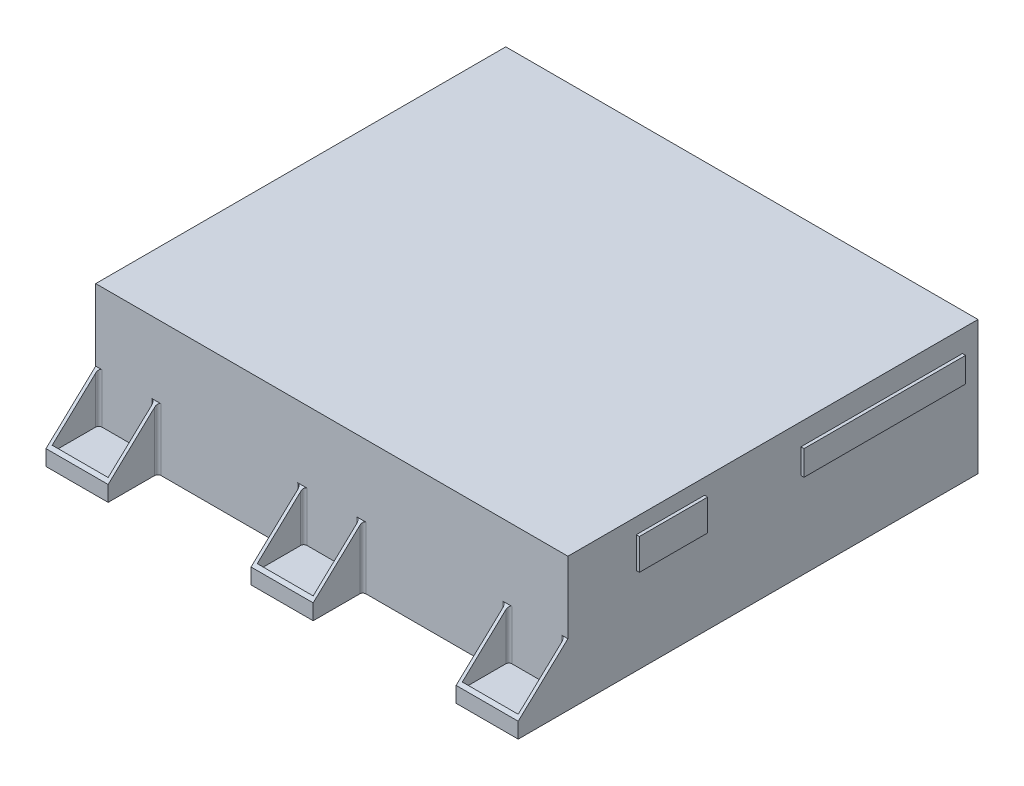
from build123d import *

# Parameters (mm, degrees)
SKETCH1_W           = 152
SKETCH1_H           = 40
BOSS_EXTRUDE1_DEPTH = 132
SKETCH2_W           = 152
SKETCH2_H           = 132
BOSS_EXTRUDE2_DEPTH = 3
SKETCH4_W           = 20
SKETCH4_H           = 20
BOSS_EXTRUDE3_DEPTH = 16
SKETCH7_W           = 18
SKETCH7_H           = 15
CUT_EXTRUDE1_DEPTH  = 16
CUT_EXTRUDE2_DEPTH  = 214.39400179
FILLET1_R           = 1
SKETCH9_W           = 22
SKETCH9_H           = 10
SKETCH9_W_2         = 52
SKETCH9_H_2         = 8
BOSS_EXTRUDE4_DEPTH = 1


with BuildPart() as part:
    # Sketch1 → Boss-Extrude1 (new body)
    with BuildSketch(Plane.XY):
        Rectangle(SKETCH1_W, SKETCH1_H)
    extrude(amount=BOSS_EXTRUDE1_DEPTH)

    # Sketch2 → Boss-Extrude2 (add)
    with BuildSketch(Plane(origin=(0, 20, 0), x_dir=(1, 0, 0), z_dir=(0, 1, 0))):
        with Locations((0, -66)):
            Rectangle(SKETCH2_W, SKETCH2_H)
    extrude(amount=BOSS_EXTRUDE2_DEPTH)

    # Sketch4 → Boss-Extrude3 (add)
    with BuildSketch(Plane.XY.offset(132)):
        with Locations((-66, -10)):
            Rectangle(SKETCH4_W, SKETCH4_H)
        with Locations((66, -10)):
            Rectangle(SKETCH4_W, SKETCH4_H)
        with Locations((0, -10)):
            Rectangle(SKETCH4_W, SKETCH4_H)
    extrude(amount=BOSS_EXTRUDE3_DEPTH)

    # Sketch7 → Cut-Extrude1 (cut)
    with BuildSketch(Plane(origin=(0, 0, 0), x_dir=(1, 0, 0), z_dir=(0, 1, 0))):
        with Locations((66, -139.5)):
            Rectangle(SKETCH7_W, SKETCH7_H)
        with Locations((0, -139.5)):
            Rectangle(SKETCH7_W, SKETCH7_H)
        with Locations((-66, -139.5)):
            Rectangle(SKETCH7_W, SKETCH7_H)
    extrude(amount=-CUT_EXTRUDE1_DEPTH, mode=Mode.SUBTRACT)

    # Sketch8 → Cut-Extrude2 (cut, through all)
    with BuildSketch(Plane(origin=(76, 0, 0), x_dir=(0, 0, -1), z_dir=(1, 0, 0))):
        Polygon((-132, 0), (-148, -15), (-148, 0), align=None)
    extrude(amount=-CUT_EXTRUDE2_DEPTH, mode=Mode.SUBTRACT)

    # Fillet1
    fillet1_edges = [part.edges().sort_by_distance(p)[0] for p in [
        (-56, -10, 132),
        (56, -10, 132),
        (-10, -10, 132),
        (10, -10, 132),
        (57, -8, 132),
        (75, -8, 132),
        (-9, -8, 132),
        (9, -8, 132),
        (-75, -8, 132),
        (-57, -8, 132),
    ]]
    fillet(fillet1_edges, radius=FILLET1_R)

    # Sketch9 → Boss-Extrude4 (add)
    with BuildSketch(Plane(origin=(76, 0, 0), x_dir=(0, 0, -1), z_dir=(1, 0, 0))):
        with Locations((-99, 13)):
            Rectangle(SKETCH9_W, SKETCH9_H)
        with Locations((-31, 12)):
            Rectangle(SKETCH9_W_2, SKETCH9_H_2)
    extrude(amount=BOSS_EXTRUDE4_DEPTH)


solid = part.part
